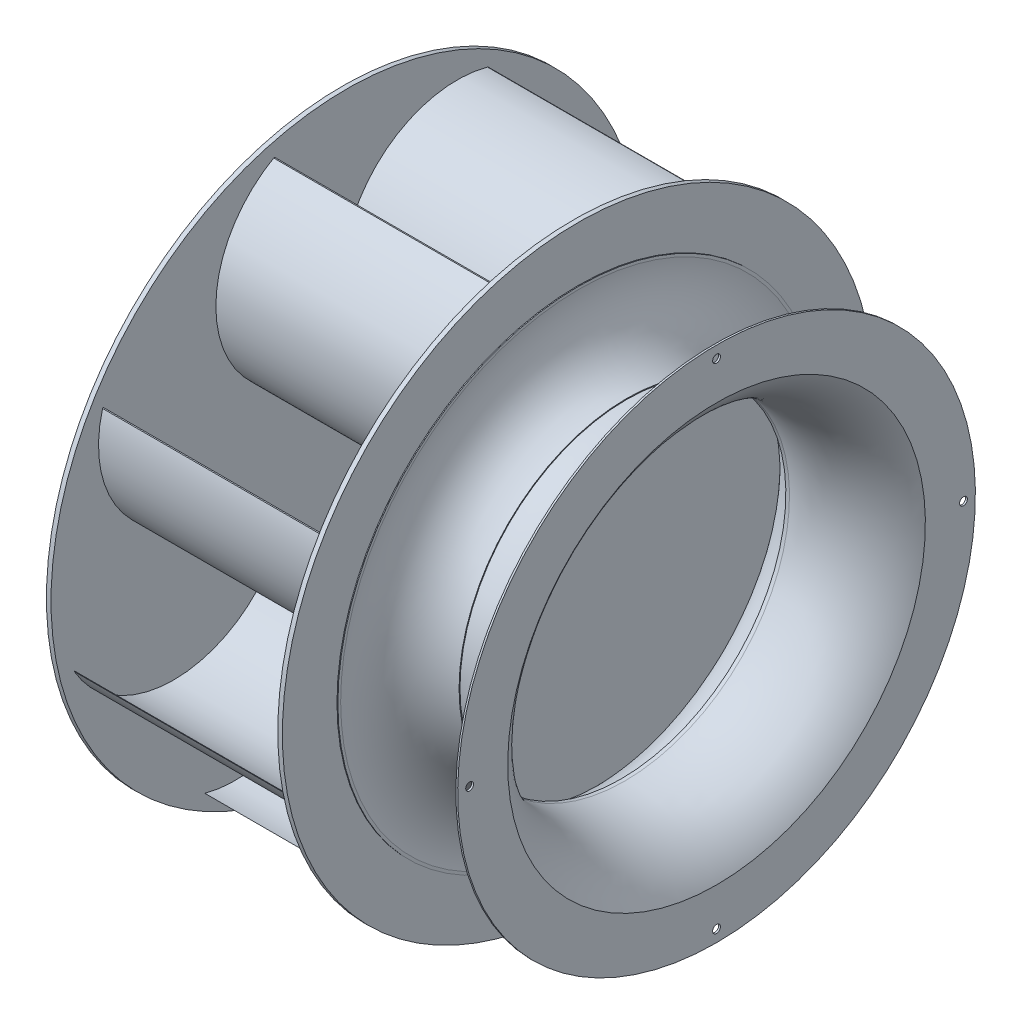
from build123d import *

# Parameters (mm, degrees)
SKETCH2_R         = 322
EXTRUDE1_DEPTH    = 5
SKETCH9_R         = 317
SKETCH9_R_2       = 100
EXTRUDE7_DEPTH    = 3
SKETCH3_R         = 322
EXTRUDE2_DEPTH    = 5
EXTRUDE3_DEPTH    = 252
CIRPATTERN1_COUNT = 8
SKETCH7_R         = 4.25
EXTRUDE5_DEPTH    = 5
CIRPATTERN2_COUNT = 4
SKETCH8_R         = 5
EXTRUDE6_DEPTH    = 90
CIRPATTERN3_COUNT = 8


with BuildPart() as part:
    # Sketch1 → Revolve1 (revolve)
    with BuildSketch(Plane.XY, mode=Mode.PRIVATE) as revolve1_sk:
        with BuildLine():
            Line((0, 0), (0, 109))
            ThreePointArc((0, 109), (1.464466094, 112.535533906), (5, 114))
            Line((5, 114), (70, 114))
            Line((70, 114), (70, 138))
            Line((70, 138), (90, 138))
            Line((90, 138), (90, 98))
            Line((90, 98), (95, 98))
            Line((95, 98), (95, 133))
            Line((95, 133), (105, 133))
            Line((105, 133), (105, 98))
            Line((105, 98), (129, 98))
            Line((129, 98), (129, 0))
            Line((129, 0), (0, 0))
        make_face()
    revolve(revolve1_sk.sketch.rotate(Axis((0, 0, 0), (1, 0, 0)), 90), axis=Axis((0, 0, 0), (1, 0, 0)))

    # Sketch2 → Extrude1 (add)
    with BuildSketch(Plane(origin=(129, 0, 0), x_dir=(0, 0, -1), z_dir=(1, 0, 0))):
        Circle(SKETCH2_R)
    extrude(amount=EXTRUDE1_DEPTH)

    # Sketch9 → Extrude7 (cut)
    with BuildSketch(Plane.ZY.offset(-129)):
        Circle(SKETCH9_R)
        Circle(SKETCH9_R_2, mode=Mode.SUBTRACT)
    extrude(amount=-EXTRUDE7_DEPTH, mode=Mode.SUBTRACT)



with BuildPart() as body_2:
    # Sketch3 → Extrude2 (new body)
    with BuildSketch(Plane(origin=(381, 0, 0), x_dir=(0, 0, -1), z_dir=(1, 0, 0))):
        Circle(SKETCH3_R)
    extrude(amount=EXTRUDE2_DEPTH)


with BuildPart() as part_1:
    add(part.part)

    add(body_2.part)  # Extrude3 merges body 2
    # Sketch4 → Extrude3 (add)
    with BuildSketch(Plane(origin=(134, 0, 0), x_dir=(0, 0, -1), z_dir=(1, 0, 0))):
        with BuildLine():
            Line((0, 112.5), (0.866025404, 112))
            ThreePointArc((0.866025404, 112), (33.143390798, 233.195288477), (154.366025404, 265.369798962))
            Line((154.366025404, 265.369798962), (153.5, 265.869798962))
            ThreePointArc((153.5, 265.869798962), (32.277365394, 233.695288477), (0, 112.5))
        make_face()
    extrude3 = extrude(amount=EXTRUDE3_DEPTH)

    # CirPattern1: Extrude3 ×8 about axis
    cirpattern1_axis = Axis((0, 0, 0), (1, 0, 0))
    for i in range(1, CIRPATTERN1_COUNT):
        add(extrude3.rotate(cirpattern1_axis, i * 360 / CIRPATTERN1_COUNT))

    # Sketch5 → Revolve2 (revolve)
    with BuildSketch(Plane.XY, mode=Mode.PRIVATE) as revolve2_sk:
        with BuildLine():
            Line((386, 262.5), (387, 262.5))
            Line((387, 262.5), (387, 259.5))
            ThreePointArc((387, 259.5), (398.382738322, 211.128602503), (439, 182.5))
            Line((439, 182.5), (439, 181.5))
            ThreePointArc((439, 181.5), (397.394502599, 210.236008176), (386, 259.5))
            Line((386, 259.5), (386, 262.5))
        make_face()
    revolve(revolve2_sk.sketch.rotate(Axis((0, 0, 0), (1, 0, 0)), 90), axis=Axis((0, 0, 0), (1, 0, 0)))

    # Sketch8 → Extrude6 (cut)
    with BuildSketch(Plane(origin=(0, 0, 0), x_dir=(0, 0, -1), z_dir=(1, 0, 0))):
        with Locations(Location((0, 126, 0), (0, 0, 180))):
            Circle(SKETCH8_R)
    extrude6 = extrude(amount=EXTRUDE6_DEPTH, mode=Mode.SUBTRACT)

    # CirPattern3: Extrude6 ×8 about axis
    cirpattern3_axis = Axis((0, 0, 0), (1, 0, 0))
    for i in range(1, CIRPATTERN3_COUNT):
        add(extrude6.rotate(cirpattern3_axis, i * 360 / CIRPATTERN3_COUNT), mode=Mode.SUBTRACT)


with BuildPart() as body_2_2:
    # Sketch6 → Revolve3 (revolve)
    with BuildSketch(Plane.XY, mode=Mode.PRIVATE) as revolve3_sk:
        with BuildLine():
            Line((537, 282), (535, 282))
            Line((535, 282), (535, 227.5))
            ThreePointArc((535, 227.5), (492.763122811, 190.091607925), (437, 181.5))
            Line((437, 181.5), (433, 181.5))
            Line((433, 181.5), (433, 179.5))
            Line((433, 179.5), (437, 179.5))
            ThreePointArc((437, 179.5), (494.265305263, 188.363947369), (537, 227.5))
            Line((537, 227.5), (537, 282))
        make_face()
    revolve(revolve3_sk.sketch.rotate(Axis((0, 0, 0), (1, 0, 0)), 180), axis=Axis((0, 0, 0), (1, 0, 0)))

    # Sketch7 → Extrude5 (cut)
    with BuildSketch(Plane(origin=(537, 0, 0), x_dir=(0, 0, -1), z_dir=(1, 0, 0))):
        with Locations((0, 269)):
            Circle(SKETCH7_R)
    extrude5 = extrude(amount=-EXTRUDE5_DEPTH, mode=Mode.SUBTRACT)

    # CirPattern2: Extrude5 ×4 about axis
    cirpattern2_axis = Axis((0, 0, 0), (1, 0, 0))
    for i in range(1, CIRPATTERN2_COUNT):
        add(extrude5.rotate(cirpattern2_axis, i * 360 / CIRPATTERN2_COUNT), mode=Mode.SUBTRACT)


solid = Compound([part_1.part, body_2_2.part])
